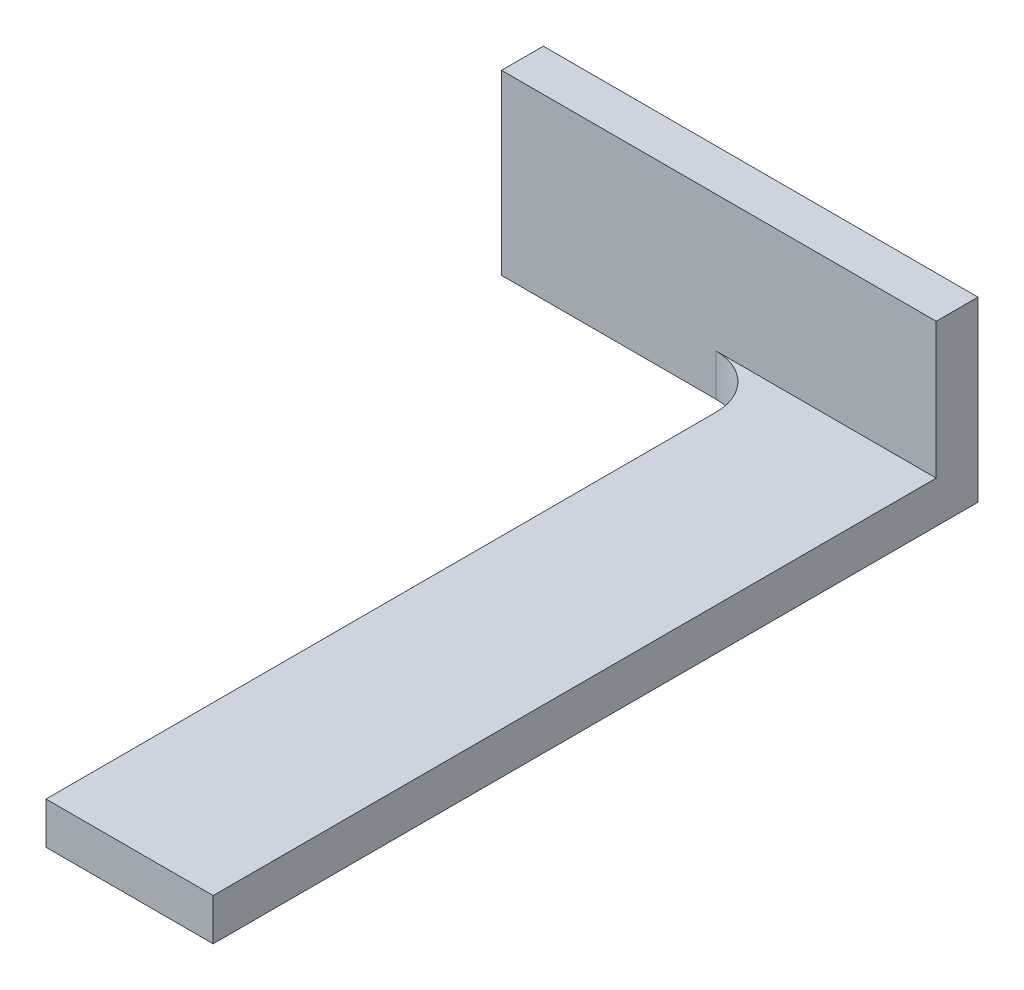
from build123d import *

# Parameters (mm, degrees)
SKETCH1_W      = 52
SKETCH1_H      = 21.25
EXTRUDE1_DEPTH = 5
SKETCH2_W      = 20
SKETCH2_H      = 5
EXTRUDE2_DEPTH = 86.5
FILLET1_R      = 6.35


with BuildPart() as part:
    # Sketch1 → Extrude1 (new body)
    with BuildSketch(Plane.XY):
        with Locations((26, -10.625)):
            Rectangle(SKETCH1_W, SKETCH1_H)
    extrude(amount=EXTRUDE1_DEPTH)

    # Sketch2 → Extrude2 (add)
    with BuildSketch(Plane.XY.offset(5)):
        with Locations((42, -18.75)):
            Rectangle(SKETCH2_W, SKETCH2_H)
    extrude(amount=EXTRUDE2_DEPTH)

    # Fillet1
    fillet1_edges = [part.edges().sort_by_distance(p)[0] for p in [
        (32, -18.75, 5),
    ]]
    fillet(fillet1_edges, radius=FILLET1_R)


solid = part.part
